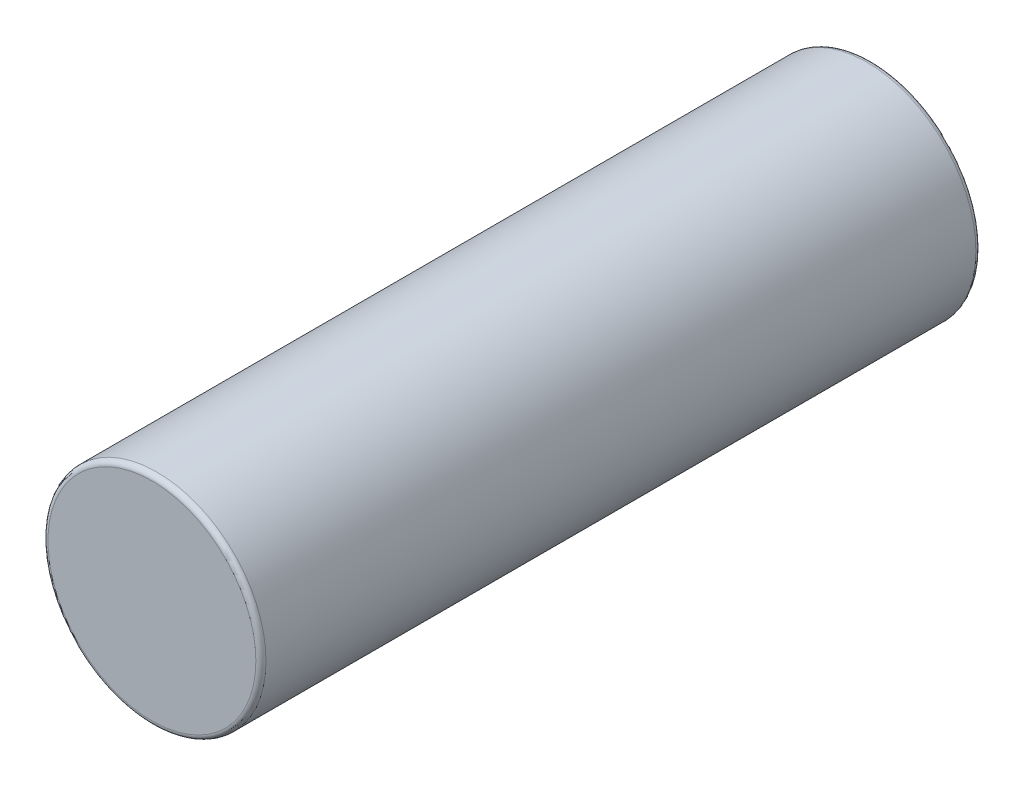
from build123d import *

# Parameters (mm, degrees)
SKIZZE1_R                       = 10.75
AUFSATZ_LINEAR_AUSTRAGEN1_DEPTH = 71
VERRUNDUNG1_R                   = 0.5


with BuildPart() as part:
    # Skizze1 → Aufsatz-Linear austragen1 (new body)
    with BuildSketch(Plane.XY):
        with Locations((156.432165941, 44.267111819)):
            Circle(SKIZZE1_R)
    extrude(amount=AUFSATZ_LINEAR_AUSTRAGEN1_DEPTH)

    # Verrundung1
    verrundung1_edges = [part.edges().sort_by_distance(p)[0] for p in [
        (145.682165941, 44.267111819, 0),
        (145.682165941, 44.267111819, 71),
    ]]
    fillet(verrundung1_edges, radius=VERRUNDUNG1_R)


solid = part.part
